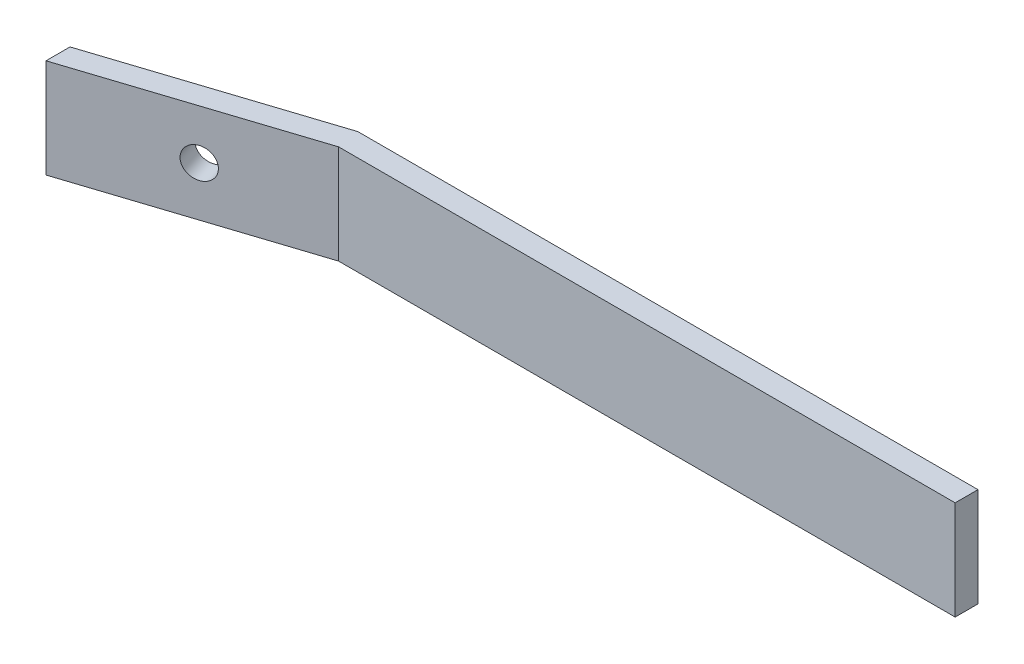
from build123d import *

# Parameters (mm, degrees)
SKETCH1_W           = 150
SKETCH1_H           = 13
BOSS_EXTRUDE1_DEPTH = 40
CUT_EXTRUDE1_DEPTH  = 40
CUT_EXTRUDE3_DEPTH  = 86.988371307
SKETCH8_R           = 2
CUT_EXTRUDE7_DEPTH  = 6.5
SKETCH4_W           = 40
SKETCH4_H           = 13
CUT_EXTRUDE10_DEPTH = 77.299594056


with BuildPart() as part:
    # Sketch1 → Boss-Extrude1 (new body)
    with BuildSketch(Plane.XY):
        Rectangle(SKETCH1_W, SKETCH1_H)
    extrude(amount=BOSS_EXTRUDE1_DEPTH)

    # Sketch2 → Cut-Extrude1 (cut)
    with BuildSketch(Plane.XZ.offset(6.5)):
        Polygon((-75, 9.270509831), (-46.468304511, 0), (-75, 0), align=None)
    extrude(amount=-CUT_EXTRUDE1_DEPTH, mode=Mode.SUBTRACT)

    # Sketch3 → Cut-Extrude3 (cut, through all)
    with BuildSketch(Plane.XZ.offset(6.5)):
        Polygon((-75, 12.424896504), (-45.99315119, 3), (75, 3), (75, 40), (-75, 40), align=None)
    extrude(amount=-CUT_EXTRUDE3_DEPTH, mode=Mode.SUBTRACT)

    # Sketch8 → Cut-Extrude7 (cut)
    with BuildSketch(Plane(origin=(-4.437328231, 0, -13.656692045), x_dir=(-0.9510565162951532, 0, 0.30901699437494873), z_dir=(-0.30901699437494873, 0, -0.9510565162951532))):
        with Locations((59.193983807, 0)):
            Circle(SKETCH8_R)
    extrude(amount=-CUT_EXTRUDE7_DEPTH, mode=Mode.SUBTRACT)

    # Sketch4 → Cut-Extrude10 (cut, through all)
    with BuildSketch(Plane.XY):
        with Locations((55, 0)):
            Rectangle(SKETCH4_W, SKETCH4_H)
    extrude(amount=CUT_EXTRUDE10_DEPTH, mode=Mode.SUBTRACT)


solid = part.part
